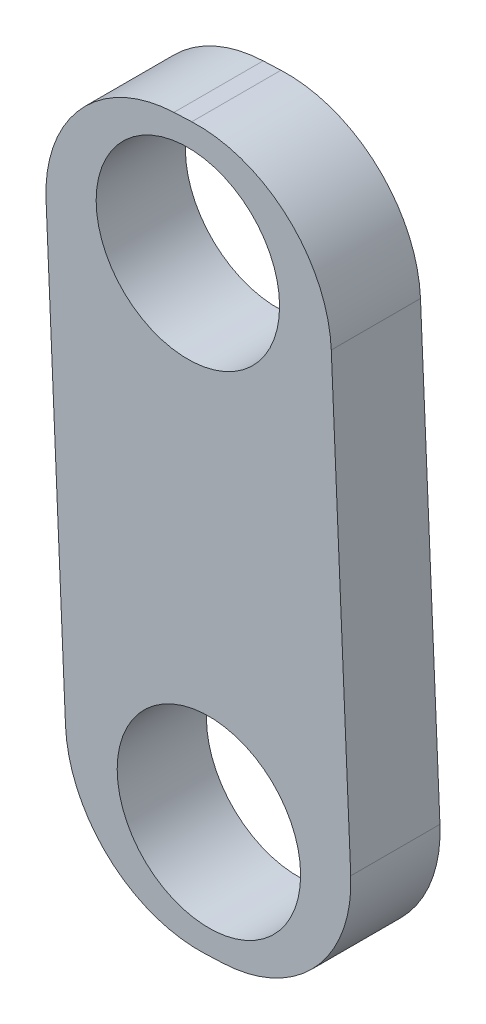
from build123d import *

# Parameters (mm, degrees)
SKETCH1_R           = 3.2639
BOSS_EXTRUDE1_DEPTH = 3.175
FILLET1_R           = 4.7625
SKETCH2_R           = 3.2639
CUT_EXTRUDE1_DEPTH  = 3.175


with BuildPart() as part:
    # Sketch1 → Boss-Extrude1 (new body)
    with BuildSketch(Plane.XY):
        Polygon((200.996661906, 21.487802882), (190.846331975, 21.044629906), (191.954264414, -4.331194922), (202.104594345, -3.888021946), align=None)
        with Locations((196.85, 0)):
            Circle(SKETCH1_R, mode=Mode.SUBTRACT)
        with Locations((196.100926319, 17.15660796)):
            Circle(SKETCH1_R, mode=Mode.SUBTRACT)
    extrude(amount=BOSS_EXTRUDE1_DEPTH)

    # Fillet1
    fillet1_edges = [part.edges().sort_by_distance(p)[0] for p in [
        (202.104594345, -3.888021946, 1.5875),
        (191.954264414, -4.331194922, 1.5875),
        (190.846331975, 21.044629906, 1.5875),
        (200.996661906, 21.487802882, 1.5875),
    ]]
    fillet(fillet1_edges, radius=FILLET1_R)

    # Sketch2 → Cut-Extrude1 (cut)
    with BuildSketch(Plane(origin=(191.400298194, 8.356717492, 0), x_dir=(0, 0, 1), z_dir=(-0.9990482215818578, -0.043619387365334696, 0))):
        with Locations((-0.79375, 0)):
            Circle(SKETCH2_R)
    extrude(amount=-CUT_EXTRUDE1_DEPTH, mode=Mode.SUBTRACT)


solid = part.part
